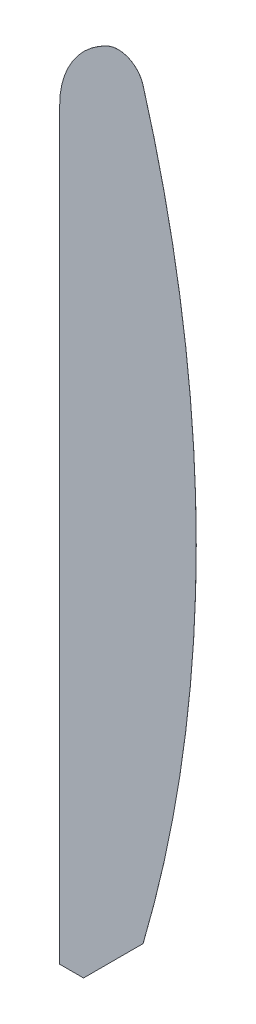
from build123d import *

# Parameters (mm, degrees)
BOSS_EXTRUDE1_DEPTH = 0.01


with BuildPart() as part:
    # Sketch1 → Boss-Extrude1 (new body)
    with BuildSketch(Plane(origin=(0, 0, 0), x_dir=(0, 1, 0), z_dir=(0, 0, 1))):
        with BuildLine():
            Line((0, 0), (156.348, 0))
            ThreePointArc((156.348, 0), (165.634887315, -2.713419175), (172, -10))
            ThreePointArc((172, -10), (172.016585971, -14.531461982), (168.592815415, -17.5))
            ThreePointArc((168.592815415, -17.5), (90.546407707, -28.666666667), (12.5, -17.5))
            Line((12.5, -17.5), (0, -5))
            Line((0, -5), (0, 0))
        make_face()
    extrude(amount=BOSS_EXTRUDE1_DEPTH)


solid = part.part
